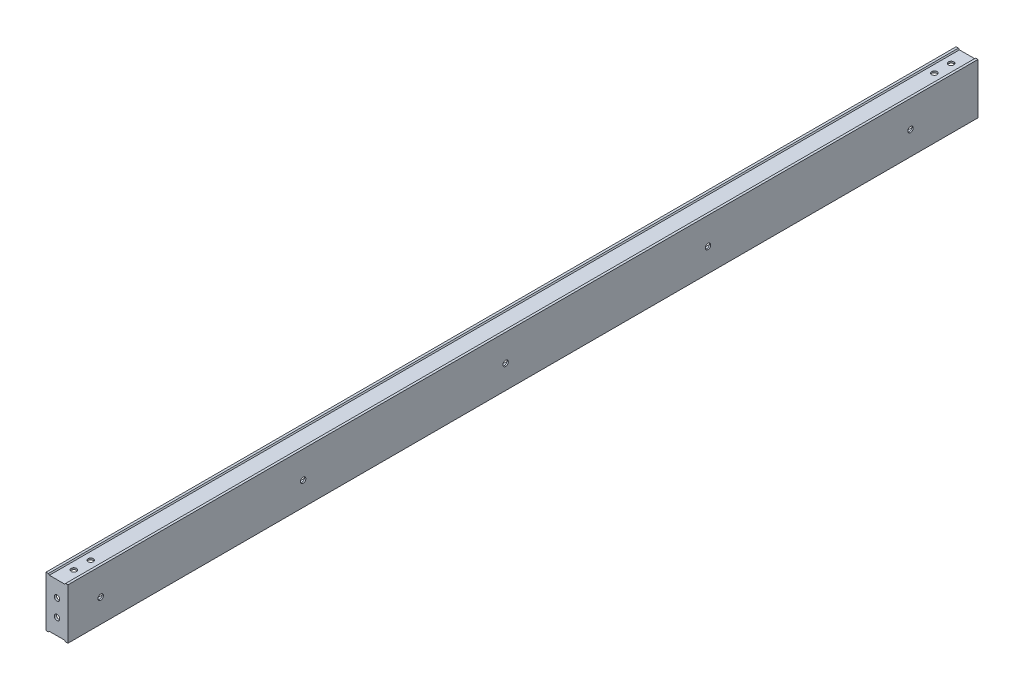
from build123d import *

# Parameters (mm, degrees)
EXTRUDE_1_DEPTH             = 2697
SKETCH_2_W                  = 61
SKETCH_2_H                  = 134
EXTRUDE_2_DEPTH             = 6
SKETCH_3_W                  = 61
SKETCH_3_H                  = 134
EXTRUDE_3_DEPTH             = 6
HOLE_WIZARD_16_0_16_1_D     = 16
HOLE_WIZARD_16_0_16_1_DEPTH = 5
HOLE_WIZARD_16_0_16_1_TIP   = 4.806884952
HOLE_WIZARD_16_0_16_2_D     = 16
PATTERN_LINEAR_1_COUNT      = 2
PATTERN_LINEAR_1_PITCH      = 50
HOLE_WIZARD_16_0_16_3_D     = 16
HOLE_WIZARD_16_0_16_4_D     = 16
PATTERN_LINEAR_2_COUNT      = 2
PATTERN_LINEAR_2_PITCH      = 50


with BuildPart() as part:
    # Model → 凸台-拉伸1 (new body)
    with BuildSketch(Plane.XY):
        with BuildLine():
            Line((11739.240027423, -58278.413223948), (11736.240027423, -58275.413223948))
            Line((11736.240027423, -58275.413223948), (11691.240027423, -58275.413223948))
            Line((11691.240027423, -58275.413223948), (11688.240027423, -58278.413223948))
            Line((11688.240027423, -58278.413223948), (11681.240027423, -58278.413223948))
            Line((11681.240027423, -58278.413223948), (11681.240027423, -58270.413223948))
            Line((11681.240027423, -58270.413223948), (11739.240027423, -58270.413223948))
            ThreePointArc((11739.240027423, -58270.413223948), (11741.361347766, -58269.534544291), (11742.240027423, -58267.413223948))
            Line((11742.240027423, -58267.413223948), (11742.240027423, -58139.413223948))
            ThreePointArc((11742.240027423, -58139.413223948), (11741.361347766, -58137.291903604), (11739.240027423, -58136.413223948))
            Line((11739.240027423, -58136.413223948), (11681.240027423, -58136.413223948))
            Line((11681.240027423, -58136.413223948), (11681.240027423, -58128.413223948))
            Line((11681.240027423, -58128.413223948), (11688.240027423, -58128.413223948))
            Line((11688.240027423, -58128.413223948), (11691.240027423, -58131.413223948))
            Line((11691.240027423, -58131.413223948), (11736.240027423, -58131.413223948))
            Line((11736.240027423, -58131.413223948), (11739.240027423, -58128.413223948))
            Line((11739.240027423, -58128.413223948), (11746.240027423, -58128.413223948))
            Line((11746.240027423, -58128.413223948), (11746.240027423, -58278.413223948))
            Line((11746.240027423, -58278.413223948), (11739.240027423, -58278.413223948))
        make_face()
    extrude(amount=EXTRUDE_1_DEPTH)

    # 草图2 → 凸台-拉伸2 (add)
    with BuildSketch(Plane.XY.offset(2697)):
        with Locations((11711.740027423, -58203.413223948)):
            Rectangle(SKETCH_2_W, SKETCH_2_H)
    extrude(amount=-EXTRUDE_2_DEPTH)

    # 草图3 → 凸台-拉伸3 (add)
    with BuildSketch(Plane(origin=(0, 0, 0), x_dir=(-1, 0, 0), z_dir=(0, 0, -1))):
        with Locations((-11711.740027423, -58203.413223948)):
            Rectangle(SKETCH_3_W, SKETCH_3_H)
    extrude(amount=-EXTRUDE_3_DEPTH)

    # Ø16.0 (16) 直径孔1
    with Locations(Plane.ZY.offset(-11742.240027423)):
        with Locations((200, -58208.413223948), (800, -58208.413223948), (1400, -58208.413223948), (2000, -58208.413223948), (2600, -58208.413223948)):
            Hole(HOLE_WIZARD_16_0_16_1_D / 2, depth=HOLE_WIZARD_16_0_16_1_DEPTH)
            with Locations((0, 0, -(HOLE_WIZARD_16_0_16_1_DEPTH + HOLE_WIZARD_16_0_16_1_TIP / 2))):  # 118° drill point
                Cone(0, HOLE_WIZARD_16_0_16_1_D / 2, HOLE_WIZARD_16_0_16_1_TIP, mode=Mode.SUBTRACT)

    # Ø16.0 (16) 直径孔2 (through all)
    with Locations(Plane(origin=(0, -58275.413223948, 0), x_dir=(-1, 0, 0), z_dir=(0, -1, 0))):
        with Locations((-11713.740027423, -2647)):
            hole_wizard_16_0_16_2 = Hole(HOLE_WIZARD_16_0_16_2_D / 2)

    # 阵列(线性)1: Ø16.0 (16) 直径孔2 ×2
    with Locations(*[(0, 0, -i * PATTERN_LINEAR_1_PITCH) for i in range(1, PATTERN_LINEAR_1_COUNT)]):
        add(hole_wizard_16_0_16_2, mode=Mode.SUBTRACT)

    # Ø16.0 (16) 直径孔3 (through all)
    with Locations(Plane(origin=(0, -58275.413223948, 0), x_dir=(-1, 0, 0), z_dir=(0, -1, 0))):
        with Locations((-11713.740027423, -47), (-11713.740027423, -97)):
            Hole(HOLE_WIZARD_16_0_16_3_D / 2)

    # Ø16.0 (16) 直径孔4 (through all)
    with Locations(Plane.XY.offset(2697)):
        with Locations((11713.740027423, -58178.413223948)):
            hole_wizard_16_0_16_4 = Hole(HOLE_WIZARD_16_0_16_4_D / 2)

    # 阵列(线性)2: Ø16.0 (16) 直径孔4 ×2
    with Locations(*[(0, -i * PATTERN_LINEAR_2_PITCH, 0) for i in range(1, PATTERN_LINEAR_2_COUNT)]):
        add(hole_wizard_16_0_16_4, mode=Mode.SUBTRACT)


solid = part.part
